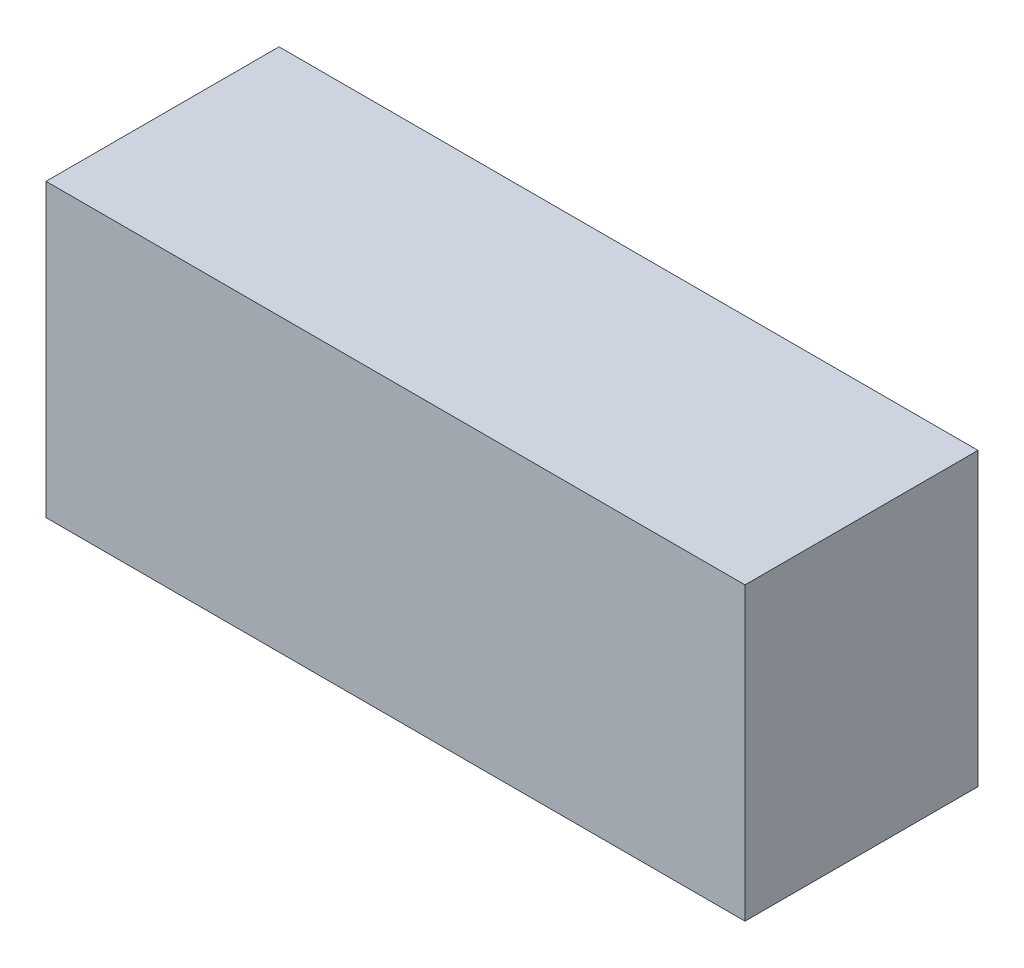
from build123d import *

# Parameters (mm, degrees)
SKETCH1_W           = 38.1
SKETCH1_H           = 12.7
BOSS_EXTRUDE1_DEPTH = 15.875


with BuildPart() as part:
    # Sketch1 → Boss-Extrude1 (new body)
    with BuildSketch(Plane(origin=(0, 0, 0), x_dir=(1, 0, 0), z_dir=(0, 1, 0))):
        Rectangle(SKETCH1_W, SKETCH1_H)
    extrude(amount=BOSS_EXTRUDE1_DEPTH)


solid = part.part
